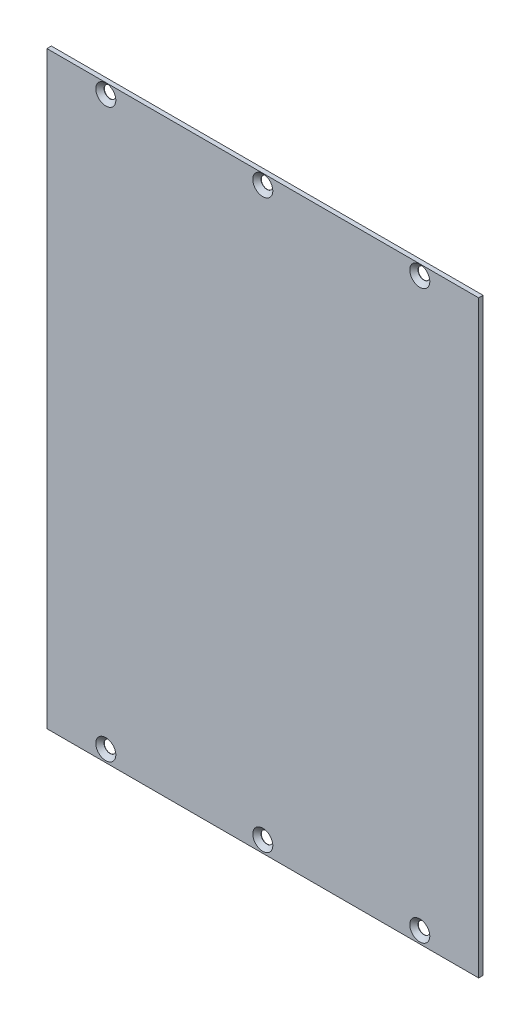
from build123d import *

# Parameters (mm, degrees)
SKETCH_1_W          = 146.6
SKETCH_1_H          = 200
EXTRUDE_1_DEPTH     = 1.5
SKETCH_2_R          = 2
CUT_EXTRUDE_1_DEPTH = 248.979454794
CHAMFER_1_SIZE      = 1.4


with BuildPart() as part:
    # Эскиз1 → Бобышка-Вытянуть1 (new body)
    with BuildSketch(Plane.XY):
        with Locations((73.3, 100)):
            Rectangle(SKETCH_1_W, SKETCH_1_H)
    extrude(amount=EXTRUDE_1_DEPTH)

    # Эскиз2 → Вырез-Вытянуть1 (cut, through all)
    with BuildSketch(Plane.XY.offset(1.5)):
        with Locations((20, 4)):
            Circle(SKETCH_2_R)
        with Locations((20, 196.5)):
            Circle(SKETCH_2_R)
        with Locations((73.3, 196.5)):
            Circle(SKETCH_2_R)
        with Locations((73.3, 4)):
            Circle(SKETCH_2_R)
        with Locations((126.6, 196.5)):
            Circle(SKETCH_2_R)
        with Locations((126.6, 4)):
            Circle(SKETCH_2_R)
    extrude(amount=-CUT_EXTRUDE_1_DEPTH, mode=Mode.SUBTRACT)

    # Фаска1
    chamfer_1_edges = [part.edges().sort_by_distance(p)[0] for p in [
        (124.6, 4, 1.5),
        (71.3, 196.5, 1.5),
        (71.3, 4, 1.5),
        (18, 196.5, 1.5),
        (124.6, 196.5, 1.5),
        (18, 4, 1.5),
    ]]
    chamfer(chamfer_1_edges, length=CHAMFER_1_SIZE)


solid = part.part
